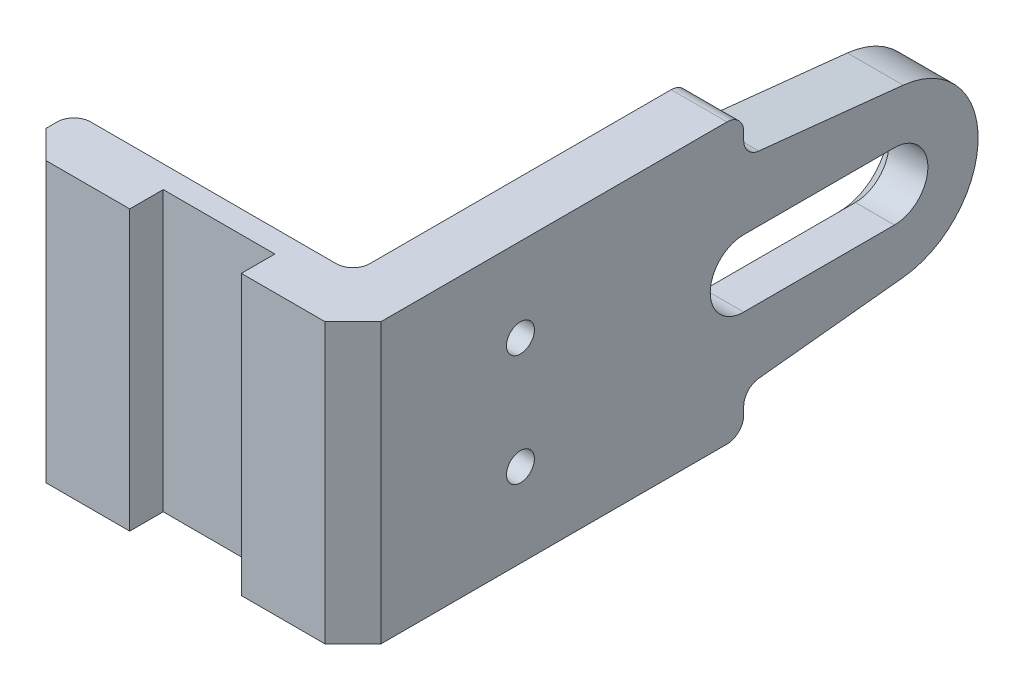
from build123d import *

# Parameters (mm, degrees)
BOSS_EXTRUDE1_DEPTH = 25
CUT_EXTRUDE1_DEPTH  = 25
CUT_EXTRUDE2_DEPTH  = 25
FILLET1_R           = 1.5
SKETCH5_R           = 1.25
CUT_EXTRUDE4_DEPTH  = 25
CUT_EXTRUDE5_START  = -2.5
SKETCH5_4_R         = 3
SKETCH5_4_R_2       = 1.25
CUT_EXTRUDE5_DEPTH  = 2.5
SKETCH7_W           = 10
SKETCH7_H           = 3
CUT_EXTRUDE6_DEPTH  = 69.271516755
CHAMFER1_SIZE       = 2.5
FILLET2_R           = 1.5
CHAMFER2_SIZE       = 1.5


with BuildPart() as part:
    # Sketch1 → Boss-Extrude1 (new body)
    with BuildSketch(Plane(origin=(0, 0, 0), x_dir=(1, 0, 0), z_dir=(0, 1, 0))):
        Polygon((0, 0), (-30, 0), (-30, 5), (-5, 5), (-5, 56), (0, 56), align=None)
    extrude(amount=BOSS_EXTRUDE1_DEPTH)

    # Sketch2 → Cut-Extrude1 (cut)
    with BuildSketch(Plane(origin=(0, 0, 0), x_dir=(0, 0, -1), z_dir=(1, 0, 0))):
        with BuildLine():
            Line((56, 25), (35, 25))
            Line((35, 25), (35, 21.460219273))
            Line((35, 21.460219273), (49.283963462, 19.958914217))
            ThreePointArc((49.283963462, 19.958914217), (54.073586187, 17.518479552), (56, 12.5))
            Line((56, 12.5), (56, 25))
        make_face()
        with BuildLine():
            ThreePointArc((56, 12.5), (54.073586128, 7.481520383), (49.283963288, 5.041085765))
            Line((49.283963288, 5.041085765), (35, 3.539780727))
            Line((35, 3.539780727), (35, 0))
            Line((35, 0), (56, 0))
            Line((56, 0), (56, 12.5))
        make_face()
    extrude(amount=-CUT_EXTRUDE1_DEPTH, mode=Mode.SUBTRACT)

    # Sketch3 → Cut-Extrude2 (cut)
    with BuildSketch(Plane(origin=(0, 0, 0), x_dir=(0, 0, -1), z_dir=(1, 0, 0))):
        with BuildLine():
            Line((35, 15.5), (48.5, 15.5))
            ThreePointArc((48.5, 15.5), (51.5, 12.5), (48.5, 9.5))
            Line((48.5, 9.5), (35, 9.5))
            ThreePointArc((35, 9.5), (32, 12.5), (35, 15.5))
        make_face()
    extrude(amount=-CUT_EXTRUDE2_DEPTH, mode=Mode.SUBTRACT)

    # Fillet1
    fillet1_edges = [part.edges().sort_by_distance(p)[0] for p in [
        (-2.5, 21.460219273, -35),
        (-2.5, 3.539780727, -35),
        (-2.5, 0, -35),
        (-2.5, 25, -35),
    ]]
    fillet(fillet1_edges, radius=FILLET1_R)

    # Sketch5 → Cut-Extrude4 (cut)
    with BuildSketch(Plane(origin=(0, 0, 0), x_dir=(0, 0, -1), z_dir=(1, 0, 0))):
        with Locations((15, 17.5)):
            Circle(SKETCH5_R)
        with Locations((15, 7.5)):
            Circle(SKETCH5_R)
    extrude(amount=-CUT_EXTRUDE4_DEPTH, mode=Mode.SUBTRACT)

    # Sketch5<4> → Cut-Extrude5 (cut)
    # profile 1 of 2: a face of its own
    with BuildSketch(Plane(origin=(0, 0, 0), x_dir=(0, 0, -1), z_dir=(1, 0, 0)).offset(CUT_EXTRUDE5_START)):
        with Locations((15, 17.5)):
            Circle(SKETCH5_4_R)
        with Locations((15, 17.5)):
            Circle(SKETCH5_4_R_2, mode=Mode.SUBTRACT)
    # profile 2 of 2: a face of its own
    with BuildSketch(Plane(origin=(0, 0, 0), x_dir=(0, 0, -1), z_dir=(1, 0, 0)).offset(CUT_EXTRUDE5_START)):
        with Locations((15, 7.5)):
            Circle(SKETCH5_4_R)
        with Locations((15, 7.5)):
            Circle(SKETCH5_4_R_2, mode=Mode.SUBTRACT)
    extrude(amount=-CUT_EXTRUDE5_DEPTH, mode=Mode.SUBTRACT)

    # Sketch7 → Cut-Extrude6 (cut, through all)
    with BuildSketch(Plane(origin=(0, 25, 0), x_dir=(1, 0, 0), z_dir=(0, 1, 0))):
        with Locations((-15, 1.5)):
            Rectangle(SKETCH7_W, SKETCH7_H)
    extrude(amount=-CUT_EXTRUDE6_DEPTH, mode=Mode.SUBTRACT)

    # Chamfer1
    chamfer1_edges = [part.edges().sort_by_distance(p)[0] for p in [
        (0, 12.5, 0),
        (-30, 12.5, 0),
    ]]
    chamfer(chamfer1_edges, length=CHAMFER1_SIZE)

    # Fillet2
    fillet2_edges = [part.edges().sort_by_distance(p)[0] for p in [
        (-30, 12.5, -5),
        (-5, 12.5, -5),
    ]]
    fillet(fillet2_edges, radius=FILLET2_R)

    # Chamfer2
    chamfer2_edges = [part.edges().sort_by_distance(p)[0] for p in [
        (-5, 9.5, -41.75),
        (-5, 12.5, -51.5),
        (-5, 12.5, -32),
        (-5, 15.5, -41.75),
    ]]
    chamfer(chamfer2_edges, length=CHAMFER2_SIZE)


solid = part.part
